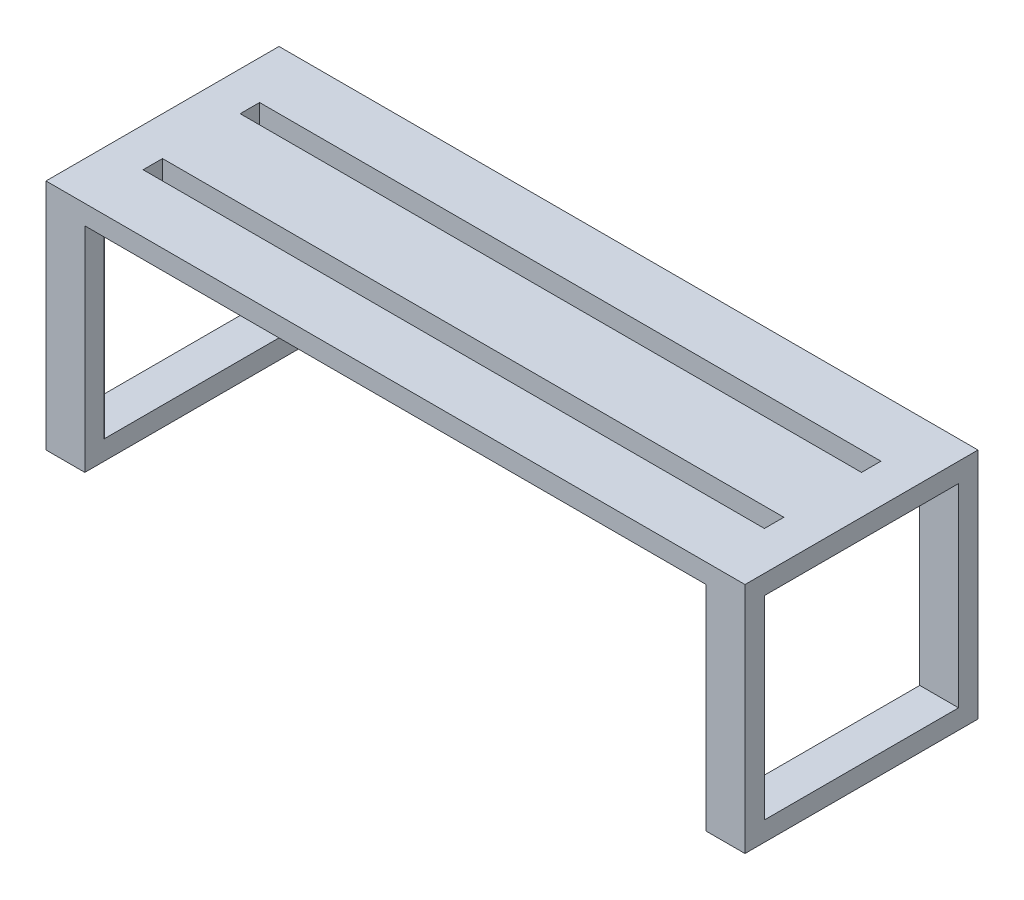
from build123d import *

# Parameters (mm, degrees)
CROQUIS2_W              = 60
CROQUIS2_H              = 60
CROQUIS2_W_2            = 50
CROQUIS2_H_2            = 50
SALIENTE_EXTRUIR1_DEPTH = 10
CROQUIS3_W              = 60
CROQUIS3_H              = 5
SALIENTE_EXTRUIR2_DEPTH = 170
CROQUIS5_W              = 10
CROQUIS5_H              = 60
SALIENTE_EXTRUIR3_DEPTH = 55
CROQUIS7_W              = 50
CROQUIS7_H              = 50.027491106
CORTAR_EXTRUIR1_DEPTH   = 10
CROQUIS8_W              = 160
CROQUIS8_H              = 5
CORTAR_EXTRUIR2_DEPTH   = 10


with BuildPart() as part:
    # Croquis2 → Saliente-Extruir1 (new body)
    with BuildSketch(Plane(origin=(0, 0, 0), x_dir=(0, 0, -1), z_dir=(1, 0, 0))):
        with Locations((0, 0.130518683)):
            Rectangle(CROQUIS2_W, CROQUIS2_H)
        with Locations((0, 0.130518683)):
            Rectangle(CROQUIS2_W_2, CROQUIS2_H_2, mode=Mode.SUBTRACT)
    extrude(amount=SALIENTE_EXTRUIR1_DEPTH)

    # Croquis3 → Saliente-Extruir2 (add)
    with BuildSketch(Plane(origin=(10, 0, 0), x_dir=(0, 0, -1), z_dir=(1, 0, 0))):
        with Locations((0, 27.630518683)):
            Rectangle(CROQUIS3_W, CROQUIS3_H)
    extrude(amount=SALIENTE_EXTRUIR2_DEPTH)

    # Croquis5 → Saliente-Extruir3 (add)
    with BuildSketch(Plane.XZ.offset(-25.130518683)):
        with Locations((175, 0)):
            Rectangle(CROQUIS5_W, CROQUIS5_H)
    extrude(amount=SALIENTE_EXTRUIR3_DEPTH)

    # Croquis7 → Cortar-Extruir1 (cut)
    with BuildSketch(Plane(origin=(180, 0, 0), x_dir=(0, 0, -1), z_dir=(1, 0, 0))):
        with Locations((0, 0.144264236)):
            Rectangle(CROQUIS7_W, CROQUIS7_H)
    extrude(amount=-CORTAR_EXTRUIR1_DEPTH, mode=Mode.SUBTRACT)

    # Croquis8 → Cortar-Extruir2 (cut)
    with BuildSketch(Plane(origin=(0, 30.130518683, 0), x_dir=(1, 0, 0), z_dir=(0, 1, 0))):
        with Locations((90, 12.5)):
            Rectangle(CROQUIS8_W, CROQUIS8_H)
        with Locations((90, -12.5)):
            Rectangle(CROQUIS8_W, CROQUIS8_H)
    extrude(amount=-CORTAR_EXTRUIR2_DEPTH, mode=Mode.SUBTRACT)


solid = part.part
